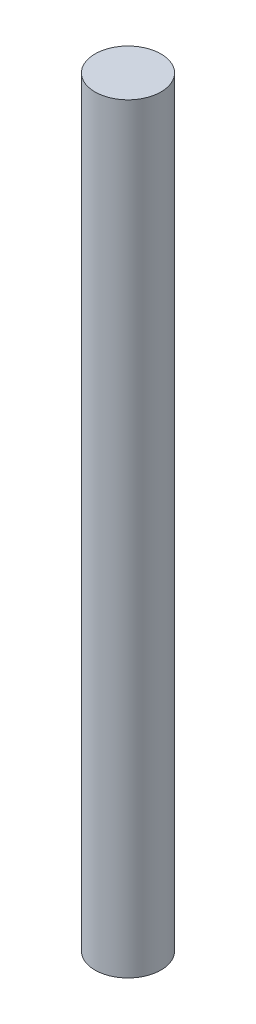
from build123d import *

# Parameters (mm, degrees)
SKETCH1_R           = 3.4365
BOSS_EXTRUDE1_DEPTH = 79.277972


with BuildPart() as part:
    # Sketch1 → Boss-Extrude1 (new body)
    with BuildSketch(Plane(origin=(0, 0, 0), x_dir=(1, 0, 0), z_dir=(0, 1, 0))):
        with Locations(Location((0, 0, 0), (0, 0, 270))):
            Circle(SKETCH1_R)
    extrude(amount=BOSS_EXTRUDE1_DEPTH)


solid = part.part
